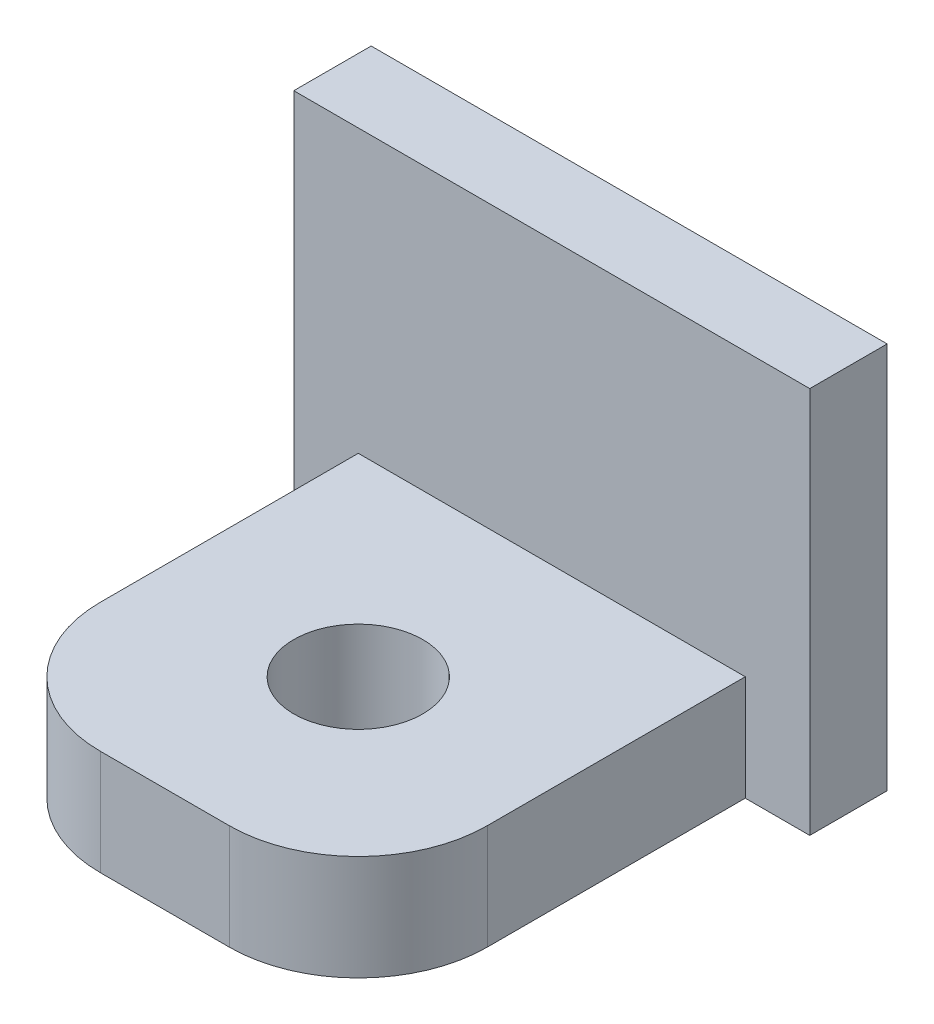
from build123d import *

# Parameters (mm, degrees)
SKETCH_1_W          = 40
SKETCH_1_H          = 30
EXTRUDE_2_DEPTH     = 6
SKETCH_2_W          = 30
SKETCH_2_H          = 8.15479
EXTRUDE_4_DEPTH     = 30
SKETCH_4_R          = 5
CUT_EXTRUDE_1_DEPTH = 51.950956811
FILLET_1_R          = 10
FILLET_2_R          = 10


with BuildPart() as part:
    # Эскиз1 → Бобышка-Вытянуть2 (new body)
    with BuildSketch(Plane.XY):
        Rectangle(SKETCH_1_W, SKETCH_1_H)
    extrude(amount=EXTRUDE_2_DEPTH)

    # Эскиз2 → Бобышка-Вытянуть4 (add)
    with BuildSketch(Plane.XY.offset(6)):
        with Locations((0, -10.922605)):
            Rectangle(SKETCH_2_W, SKETCH_2_H)
    extrude(amount=EXTRUDE_4_DEPTH)

    # Эскиз4 → Вырез-Вытянуть1 (cut, through all)
    with BuildSketch(Plane(origin=(0, -15, 0), x_dir=(-1, 0, 0), z_dir=(0, -1, 0))):
        with Locations(Location((0, -21, 0), (0, 0, 180))):
            Circle(SKETCH_4_R)
    extrude(amount=-CUT_EXTRUDE_1_DEPTH, mode=Mode.SUBTRACT)

    # Скругление1
    fillet_1_edges = [part.edges().sort_by_distance(p)[0] for p in [
        (-15, -10.922605, 36),
    ]]
    fillet(fillet_1_edges, radius=FILLET_1_R)

    # Скругление2
    fillet_2_edges = [part.edges().sort_by_distance(p)[0] for p in [
        (15, -10.922605, 36),
    ]]
    fillet(fillet_2_edges, radius=FILLET_2_R)


solid = part.part
